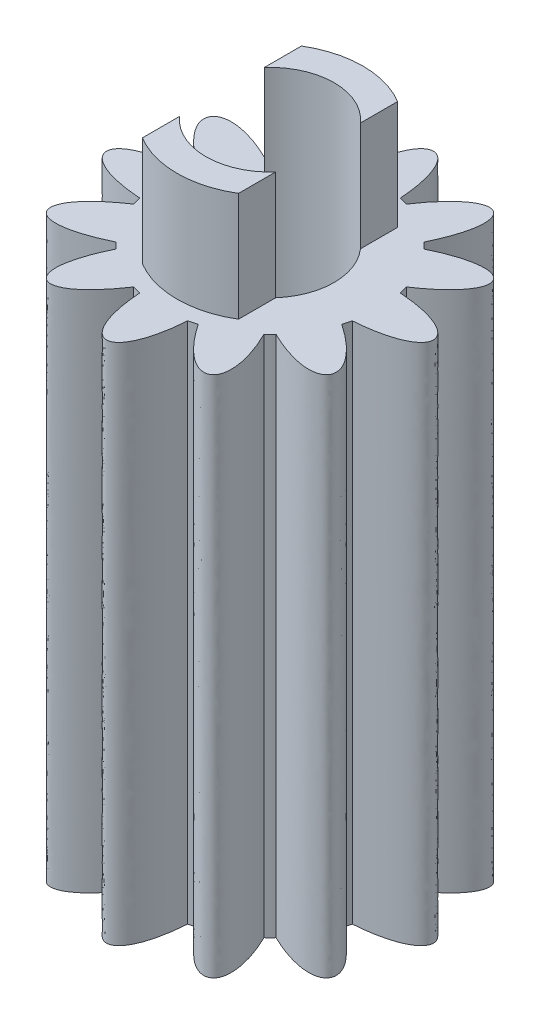
from build123d import *

# Parameters (mm, degrees)
SKETCH1_R           = 3.4
BOSS_EXTRUDE1_DEPTH = 16.3
SKETCH4_R           = 2.9
BOSS_EXTRUDE2_DEPTH = 3.4
SKETCH2_R           = 2
CUT_EXTRUDE2_DEPTH  = 19.7
SKETCH5_W           = 2
SKETCH5_H           = 12
CUT_EXTRUDE3_DEPTH  = 3.4


with BuildPart() as part:
    # Sketch1 → Boss-Extrude1 (new body)
    with BuildSketch(Plane(origin=(0, 0, 0), x_dir=(1, 0, 0), z_dir=(0, 1, 0))):
        Circle(SKETCH1_R)
        with BuildLine():
            ThreePointArc((-3.31624788, -0.75), (-3.4, 0), (-3.31624788, 0.75))
            add(Edge.make_bspline(
                [(-3.31624788, -0.75), (-5.69458404, -0.583333333), (-5.69458404, 0.583333333), (-3.31624788, 0.75)],
                knots=[0, 0, 0, 0, 1, 1, 1, 1], degree=3))
        make_face()
        with BuildLine():
            add(Edge.make_bspline(
                [(-2.496954909, -2.307642993), (-4.639987776, -3.352473506), (-5.223321109, -2.342110534), (-3.246954909, -1.008604887)],
                knots=[0, 0, 0, 0, 1, 1, 1, 1], degree=3))
            ThreePointArc((-2.496954909, -2.307642993), (-2.944486373, -1.7), (-3.246954909, -1.008604887))
        make_face()
        with BuildLine():
            add(Edge.make_bspline(
                [(-1.008604887, -3.246954909), (-2.342110534, -5.223321109), (-3.352473506, -4.639987776), (-2.307642993, -2.496954909)],
                knots=[0, 0, 0, 0, 1, 1, 1, 1], degree=3))
            ThreePointArc((-1.008604887, -3.246954909), (-1.7, -2.944486373), (-2.307642993, -2.496954909))
        make_face()
        with BuildLine():
            add(Edge.make_bspline(
                [(0.75, -3.31624788), (0.583333333, -5.69458404), (-0.583333333, -5.69458404), (-0.75, -3.31624788)],
                knots=[0, 0, 0, 0, 1, 1, 1, 1], degree=3))
            ThreePointArc((0.75, -3.31624788), (0, -3.4), (-0.75, -3.31624788))
        make_face()
        with BuildLine():
            add(Edge.make_bspline(
                [(2.307642993, -2.496954909), (3.352473506, -4.639987776), (2.342110534, -5.223321109), (1.008604887, -3.246954909)],
                knots=[0, 0, 0, 0, 1, 1, 1, 1], degree=3))
            ThreePointArc((2.307642993, -2.496954909), (1.7, -2.944486373), (1.008604887, -3.246954909))
        make_face()
        with BuildLine():
            add(Edge.make_bspline(
                [(3.246954909, -1.008604887), (5.223321109, -2.342110534), (4.639987776, -3.352473506), (2.496954909, -2.307642993)],
                knots=[0, 0, 0, 0, 1, 1, 1, 1], degree=3))
            ThreePointArc((3.246954909, -1.008604887), (2.944486373, -1.7), (2.496954909, -2.307642993))
        make_face()
        with BuildLine():
            ThreePointArc((3.31624788, 0.75), (3.378997099, 0.377330895), (3.4, 0))
            ThreePointArc((3.4, 0), (3.378997099, -0.377330895), (3.31624788, -0.75))
            add(Edge.make_bspline(
                [(3.31624788, 0.75), (5.69458404, 0.583333333), (5.69458404, -0.583333333), (3.31624788, -0.75)],
                knots=[0, 0, 0, 0, 1, 1, 1, 1], degree=3))
        make_face()
        with BuildLine():
            ThreePointArc((2.496954909, 2.307642993), (2.944486373, 1.7), (3.246954909, 1.008604887))
            add(Edge.make_bspline(
                [(2.496954909, 2.307642993), (4.639987776, 3.352473506), (5.223321109, 2.342110534), (3.246954909, 1.008604887)],
                knots=[0, 0, 0, 0, 1, 1, 1, 1], degree=3))
        make_face()
        with BuildLine():
            ThreePointArc((1.008604887, 3.246954909), (1.7, 2.944486373), (2.307642993, 2.496954909))
            add(Edge.make_bspline(
                [(1.008604887, 3.246954909), (2.342110534, 5.223321109), (3.352473506, 4.639987776), (2.307642993, 2.496954909)],
                knots=[0, 0, 0, 0, 1, 1, 1, 1], degree=3))
        make_face()
        with BuildLine():
            ThreePointArc((-3.246954909, 1.008604887), (-2.944486373, 1.7), (-2.496954909, 2.307642993))
            add(Edge.make_bspline(
                [(-3.246954909, 1.008604887), (-5.223321109, 2.342110534), (-4.639987776, 3.352473506), (-2.496954909, 2.307642993)],
                knots=[0, 0, 0, 0, 1, 1, 1, 1], degree=3))
        make_face()
        with BuildLine():
            ThreePointArc((-2.307642993, 2.496954909), (-1.7, 2.944486373), (-1.008604887, 3.246954909))
            add(Edge.make_bspline(
                [(-2.307642993, 2.496954909), (-3.352473506, 4.639987776), (-2.342110534, 5.223321109), (-1.008604887, 3.246954909)],
                knots=[0, 0, 0, 0, 1, 1, 1, 1], degree=3))
        make_face()
        with BuildLine():
            ThreePointArc((-0.75, 3.31624788), (0, 3.4), (0.75, 3.31624788))
            add(Edge.make_bspline(
                [(-0.75, 3.31624788), (-0.583333333, 5.69458404), (0.583333333, 5.69458404), (0.75, 3.31624788)],
                knots=[0, 0, 0, 0, 1, 1, 1, 1], degree=3))
        make_face()
    extrude(amount=BOSS_EXTRUDE1_DEPTH)

    # Sketch4 → Boss-Extrude2 (add)
    with BuildSketch(Plane(origin=(0, 16.3, 0), x_dir=(1, 0, 0), z_dir=(0, 1, 0))):
        with Locations(Location((0, 0, 0), (0, 0, 270))):
            Circle(SKETCH4_R)
    extrude(amount=BOSS_EXTRUDE2_DEPTH)

    # Sketch2 → Cut-Extrude2 (cut)
    with BuildSketch(Plane.XZ):
        with Locations(Location((0, 0, 0), (0, 0, 270))):
            Circle(SKETCH2_R)
    extrude(amount=-CUT_EXTRUDE2_DEPTH, mode=Mode.SUBTRACT)

    # Sketch5 → Cut-Extrude3 (cut)
    with BuildSketch(Plane(origin=(0, 16.3, 0), x_dir=(1, 0, 0), z_dir=(0, 1, 0))):
        with Locations((2.5, 0)):
            Rectangle(SKETCH5_W, SKETCH5_H)
        with Locations((-2.5, 0)):
            Rectangle(SKETCH5_W, SKETCH5_H)
    extrude(amount=CUT_EXTRUDE3_DEPTH, mode=Mode.SUBTRACT)


solid = part.part
